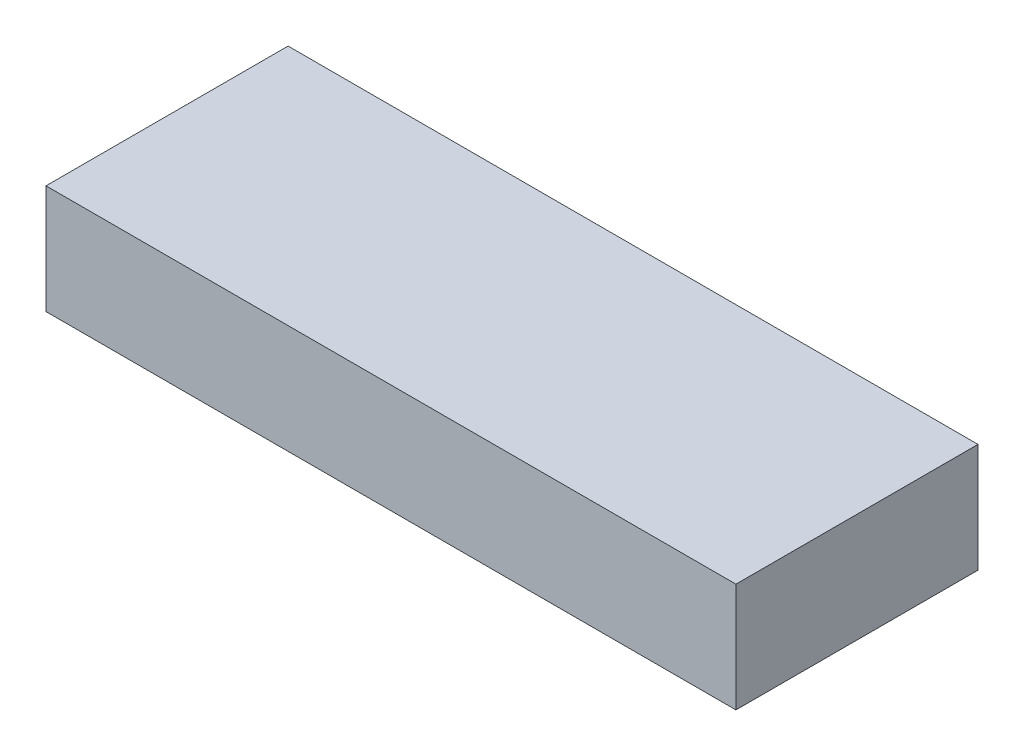
from build123d import *

# Parameters (mm, degrees)
SKETCH1_W           = 144.78
SKETCH1_H           = 50.8
BOSS_EXTRUDE1_DEPTH = 22.86


with BuildPart() as part:
    # Sketch1 → Boss-Extrude1 (new body)
    with BuildSketch(Plane(origin=(0, 0, 0), x_dir=(1, 0, 0), z_dir=(0, 1, 0))):
        Rectangle(SKETCH1_W, SKETCH1_H)
    extrude(amount=BOSS_EXTRUDE1_DEPTH)


solid = part.part
